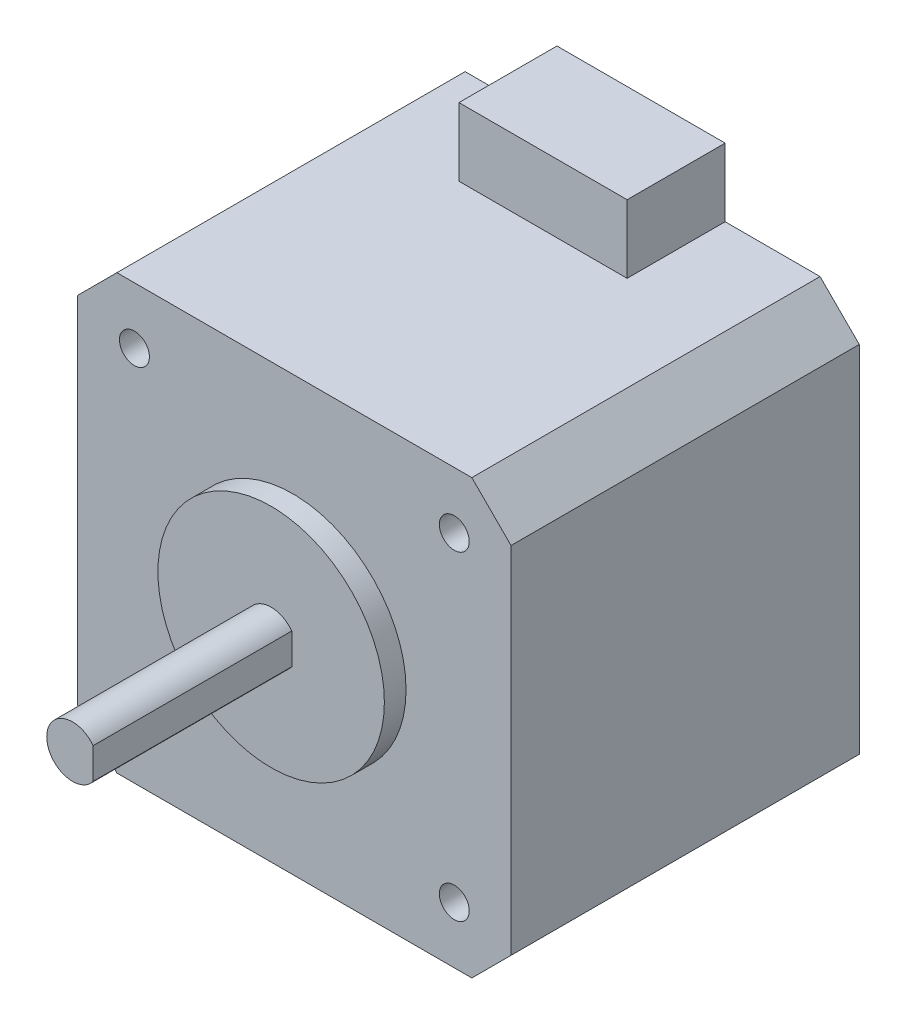
from build123d import *

# Parameters (mm, degrees)
BOSS_EXTRUDE1_DEPTH = 33.75
SKETCH1_3_W         = 16.3
SKETCH1_3_H         = 6.6
BOSS_EXTRUDE2_DEPTH = 9.5
SKETCH2_R           = 10.975
BOSS_EXTRUDE3_DEPTH = 2.1
BOSS_EXTRUDE4_DEPTH = 19.25
SKETCH4_R           = 1.45
CUT_EXTRUDE1_DEPTH  = 4.5


with BuildPart() as part:
    # Sketch1 → Boss-Extrude1 (new body)
    with BuildSketch(Plane.XY):
        Polygon((29, 42), (12.7, 42), (3.8, 42), (0, 38.2), (0, 3.8), (3.8, 0), (38.2, 0), (42, 3.8), (42, 38.2), (38.2, 42), align=None)
    extrude(amount=BOSS_EXTRUDE1_DEPTH)

    # Sketch1<3> → Boss-Extrude2 (add)
    with BuildSketch(Plane.XY):
        with Locations((20.85, 45.3)):
            Rectangle(SKETCH1_3_W, SKETCH1_3_H)
    extrude(amount=BOSS_EXTRUDE2_DEPTH)

    # Sketch2 → Boss-Extrude3 (add)
    with BuildSketch(Plane.XY.offset(33.75)):
        with Locations((20.85, 21)):
            Circle(SKETCH2_R)
    extrude(amount=BOSS_EXTRUDE3_DEPTH)

    # Sketch3 → Boss-Extrude4 (add)
    with BuildSketch(Plane.XY.offset(35.85)):
        with BuildLine():
            Line((22.85, 22.5), (22.85, 19.5))
            ThreePointArc((22.85, 19.5), (18.35, 21), (22.85, 22.5))
        make_face()
    extrude(amount=BOSS_EXTRUDE4_DEPTH)

    # Sketch4 → Cut-Extrude1 (cut)
    with BuildSketch(Plane.XY.offset(33.75)):
        with Locations((5.5, 36.5)):
            Circle(SKETCH4_R)
        with Locations((36.5, 36.5)):
            Circle(SKETCH4_R)
        with Locations((5.5, 5.5)):
            Circle(SKETCH4_R)
        with Locations((36.5, 5.5)):
            Circle(SKETCH4_R)
    extrude(amount=-CUT_EXTRUDE1_DEPTH, mode=Mode.SUBTRACT)


solid = part.part
